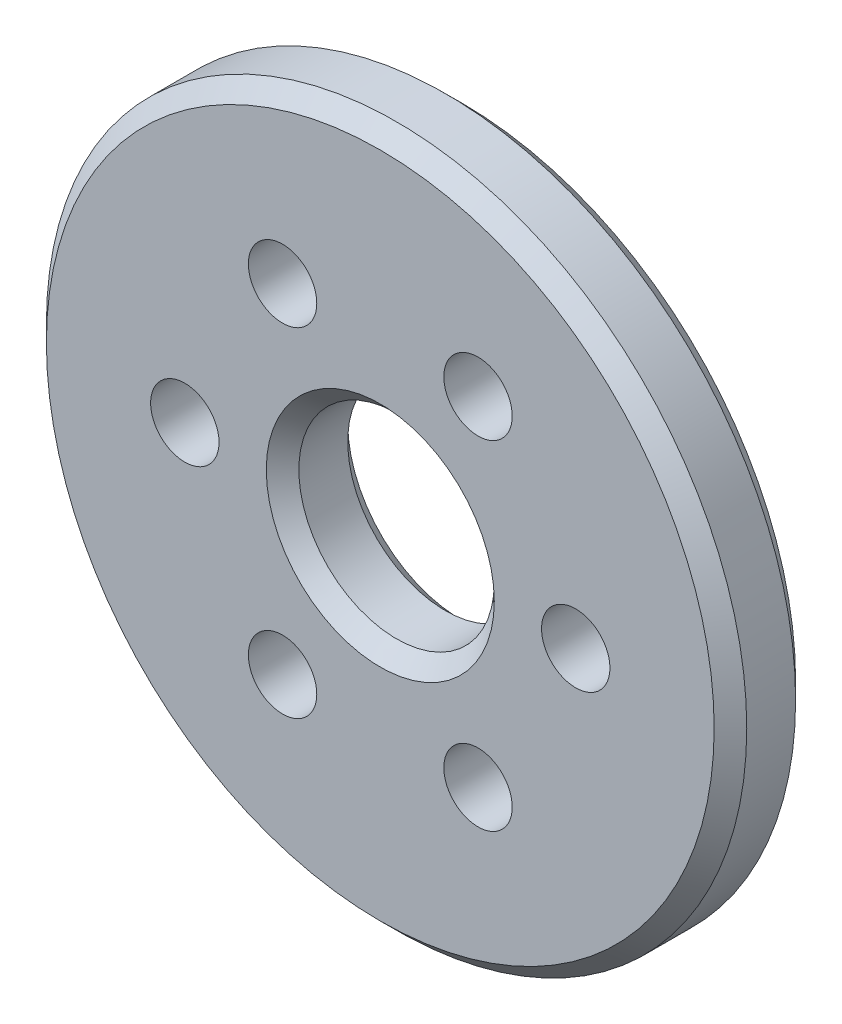
from build123d import *

# Parameters (mm, degrees)
SKETCH_1_R      = 21.5
SKETCH_1_R_2    = 2.1
SKETCH_1_R_3    = 6
EXTRUDE_1_DEPTH = 5
CHAMFER_1_SIZE  = 1


with BuildPart() as part:
    # 草图1 → 凸台-拉伸1 (new body)
    with BuildSketch(Plane.XY):
        Circle(SKETCH_1_R)
        with Locations((12, 0)):
            Circle(SKETCH_1_R_2, mode=Mode.SUBTRACT)
        with Locations((6, -10.392304845)):
            Circle(SKETCH_1_R_2, mode=Mode.SUBTRACT)
        with Locations((-6, -10.392304845)):
            Circle(SKETCH_1_R_2, mode=Mode.SUBTRACT)
        with Locations((-12, 0)):
            Circle(SKETCH_1_R_2, mode=Mode.SUBTRACT)
        with Locations((-6, 10.392304845)):
            Circle(SKETCH_1_R_2, mode=Mode.SUBTRACT)
        with Locations((6, 10.392304845)):
            Circle(SKETCH_1_R_2, mode=Mode.SUBTRACT)
        Circle(SKETCH_1_R_3, mode=Mode.SUBTRACT)
    extrude(amount=EXTRUDE_1_DEPTH)

    # 倒角1
    chamfer_1_edges = [part.edges().sort_by_distance(p)[0] for p in [
        (-21.5, 0, 0),
        (-21.5, 0, 5),
        (-6, 0, 0),
        (-6, 0, 5),
    ]]
    chamfer(chamfer_1_edges, length=CHAMFER_1_SIZE)


solid = part.part
